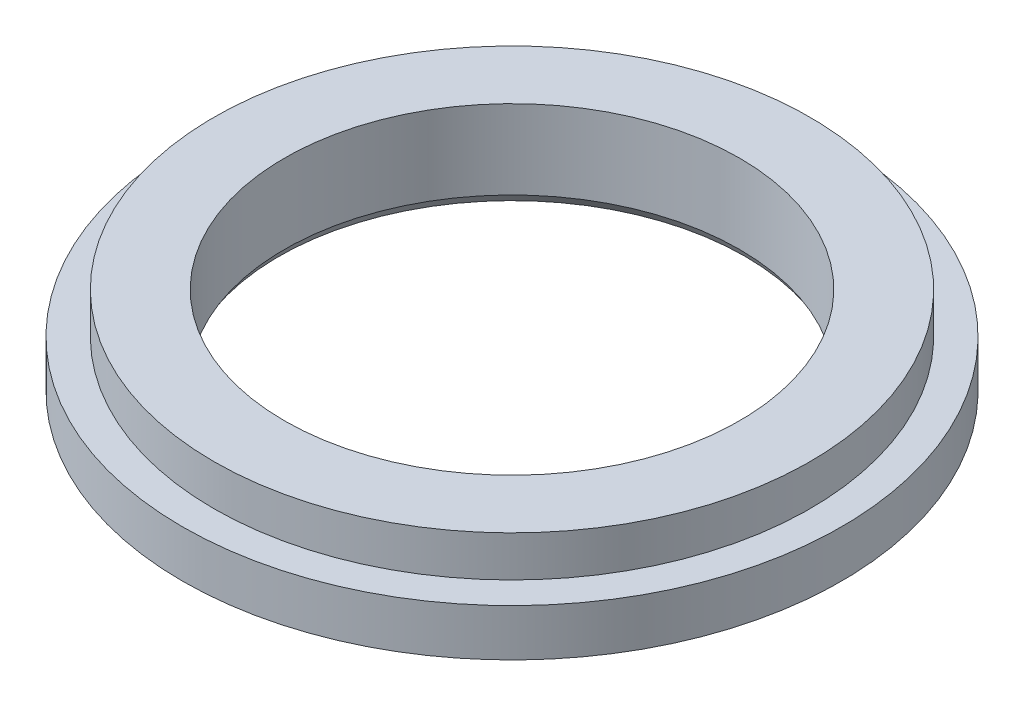
from build123d import *

# Parameters (mm, degrees)
CHAMFER1_SIZE     = 1.778
CHAMFER1_SIZE2    = 1.111017708
CIRPATTERN1_COUNT = 4


with BuildPart() as part:
    # Sketch2 → Revolve1 (revolve)
    with BuildSketch(Plane.XY, mode=Mode.PRIVATE) as revolve1_sk:
        Polygon((-46.0375, 0), (-66.675, 0), (-66.675, 9.525), (-60.325, 9.525), (-60.325, 17.78), (-46.0375, 17.78), align=None)
    revolve(revolve1_sk.sketch.rotate(Axis((0, 0, 0), (0, -1, 0)), 270), axis=Axis((0, 0, 0), (0, -1, 0)))

    # Chamfer1
    chamfer1_edges = [part.edges().sort_by_distance(p)[0] for p in [
        (0, 0, -46.0375),
    ]]
    chamfer1_side = [part.faces().sort_by_distance(p)[0] for p in [
        (0, 8.89, -46.0375),
    ]]
    chamfer(chamfer1_edges, length=CHAMFER1_SIZE, length2=CHAMFER1_SIZE2, reference=chamfer1_side[0])

    # Sketch5 → M4x0.7 Tapped Hole2 (revolve, cut)
    with BuildSketch(Plane(origin=(0, 0, 53.34), x_dir=(0, 0, -1), z_dir=(1, 0, 0))):
        Polygon((0, 0), (0, 12.617000021), (1.65, 11.62558), (1.65, 0), align=None)
    m4x0_7_tapped_hole2 = revolve(axis=Axis((0, -6.35, 53.34), (0, 1, 0)), mode=Mode.SUBTRACT)

    # CirPattern1: M4x0.7 Tapped Hole2 ×4 about axis
    cirpattern1_axis = Axis((0, 0, 0), (0, 1, 0))
    for i in range(1, CIRPATTERN1_COUNT):
        add(m4x0_7_tapped_hole2.rotate(cirpattern1_axis, i * 360 / CIRPATTERN1_COUNT), mode=Mode.SUBTRACT)


solid = part.part
